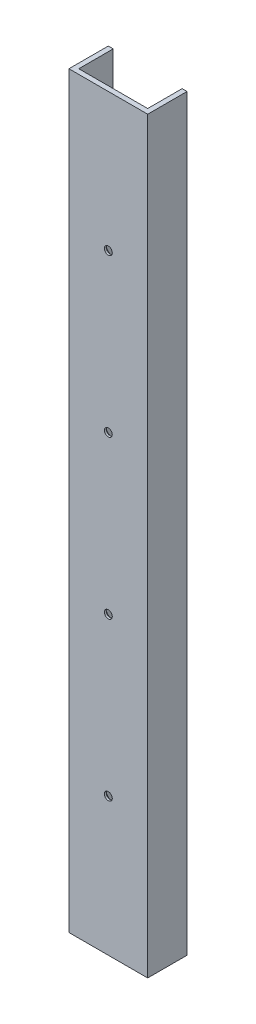
from build123d import *

# Parameters (mm, degrees)
BOSS_EXTRUDE1_DEPTH = 241.3
LPATTERN1_COUNT     = 4
LPATTERN1_PITCH     = 101.6


with BuildPart() as part:
    # Sketch1 → Boss-Extrude1 (new, symmetric)
    with BuildSketch(Plane(origin=(0, 0, 0), x_dir=(1, 0, 0), z_dir=(0, 1, 0))):
        Polygon((-25.4, 12.7), (-25.4, -12.7), (25.4, -12.7), (25.4, 12.7), (22.225, 12.7), (22.225, -9.525), (-22.225, -9.525), (-22.225, 12.7), align=None)
    extrude(amount=BOSS_EXTRUDE1_DEPTH, both=True)

    # Sketch2 → CSK for #10 Flat Head Machine Screw (100)1 (revolve, cut)
    with BuildSketch(Plane(origin=(0, -152.4, 9.525), x_dir=(0, 1, 0), z_dir=(1, 0, 0))):
        Polygon((0, 0), (0, 3.175), (2.5527, 3.175), (2.5527, 1.960808018), (4.8895, 0), align=None)
    csk_for_10_flat_head_machine_screw_100 = revolve(axis=Axis((0, -152.4, 3.175), (0, 0, 1)), mode=Mode.SUBTRACT)

    # LPattern1: CSK for #10 Flat Head Machine Screw (100)1 ×4
    with Locations(*[(0, i * LPATTERN1_PITCH, 0) for i in range(1, LPATTERN1_COUNT)]):
        add(csk_for_10_flat_head_machine_screw_100, mode=Mode.SUBTRACT)


solid = part.part
